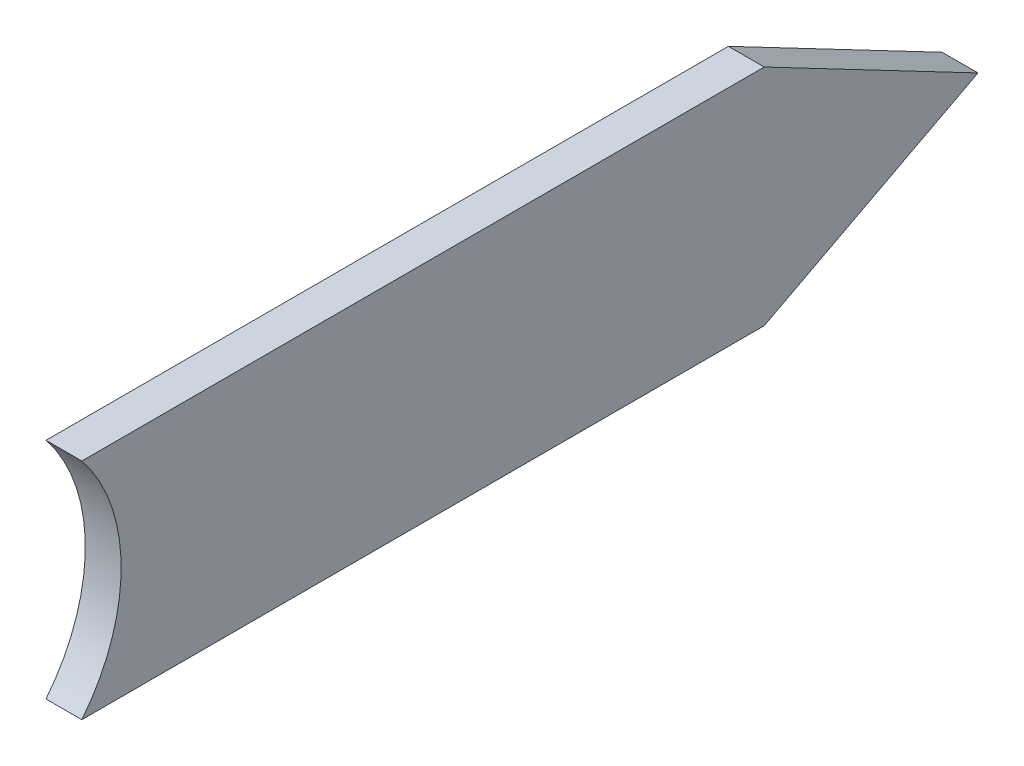
from build123d import *

# Parameters (mm, degrees)
BOSS_EXTRUDE1_DEPTH = 8


with BuildPart() as part:
    # Sketch1 → Boss-Extrude1 (new body)
    with BuildSketch(Plane(origin=(0, 0, 0), x_dir=(0, 0, -1), z_dir=(1, 0, 0))):
        with BuildLine():
            Line((100, 0), (52.293577982, 25))
            Line((52.293577982, 25), (-100, 25))
            ThreePointArc((-100, 25), (-91.224989992, 0), (-100, -25))
            Line((-100, -25), (52.293577982, -25))
            Line((52.293577982, -25), (100, 0))
        make_face()
    extrude(amount=BOSS_EXTRUDE1_DEPTH)


solid = part.part
